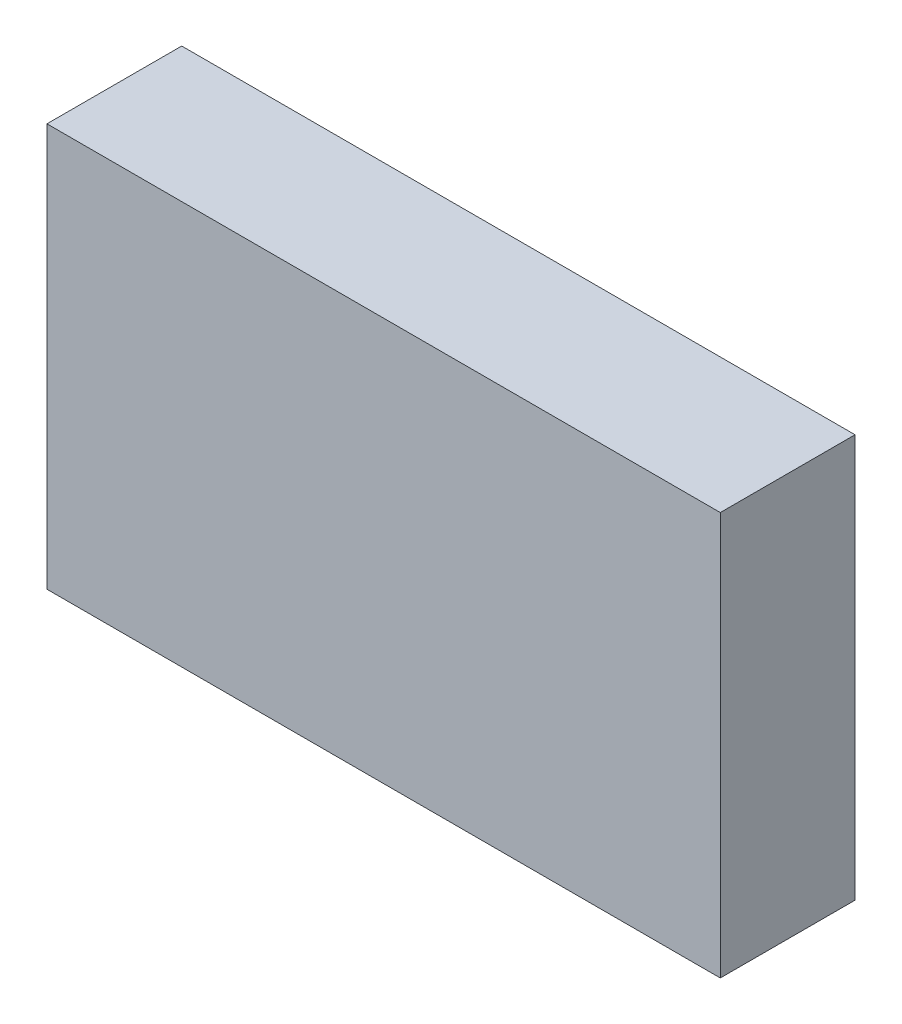
from build123d import *

# Parameters (mm, degrees)
SKIZZE1_W               = 4.9968
SKIZZE1_H               = 2.9914
COMPONENT_OUTLINE_DEPTH = 1


with BuildPart() as part:
    # Skizze1 → Component_Outline (new body)
    with BuildSketch(Plane.XY):
        with Locations((0, 0.0127)):
            Rectangle(SKIZZE1_W, SKIZZE1_H)
    extrude(amount=COMPONENT_OUTLINE_DEPTH)


solid = part.part
